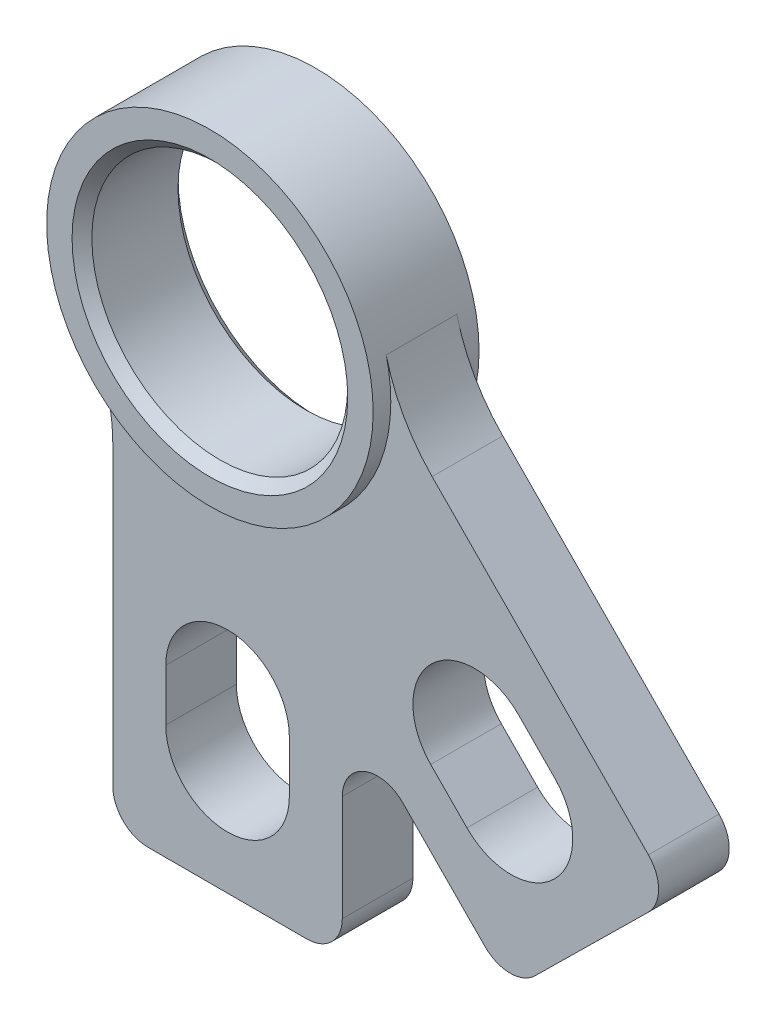
from build123d import *

# Parameters (mm, degrees)
SKETCH1_R           = 11.5062
BOSS_EXTRUDE2_DEPTH = 4.7625
BOSS_EXTRUDE3_DEPTH = 3.175
FILLET1_R           = 3.175
CHAMFER1_SIZE       = 0.889


with BuildPart() as part:
    # Sketch1 → Boss-Extrude2 (new, symmetric)
    with BuildSketch(Plane.XY):
        with BuildLine():
            ThreePointArc((14.269628052, 3.451861627), (-5.569873551, 13.583598274), (-12.585193267, -7.559797873))
            ThreePointArc((-12.585193267, -7.559797873), (5.569873551, -13.583598274), (14.269628052, 3.451861627))
        make_face()
        Circle(SKETCH1_R, mode=Mode.SUBTRACT)
    extrude(amount=BOSS_EXTRUDE2_DEPTH, both=True)

    # Sketch1<4> → Boss-Extrude3 (add, symmetric)
    with BuildSketch(Plane.XY):
        with BuildLine():
            ThreePointArc((-12.585193267, -7.559797873), (-10.89585042, -11.492870345), (-10.31875, -15.734319794))
            Line((-10.31875, -15.734319794), (-10.31875, -45.604827057))
            Line((-10.31875, -45.604827057), (10.31875, -45.604827057))
            Line((10.31875, -45.604827057), (10.31875, -25.164979673))
            Line((10.31875, -25.164979673), (25.381793208, -40.444315924))
            Line((25.381793208, -40.444315924), (40.07836036, -25.955792184))
            Line((40.07836036, -25.955792184), (18.394537525, -3.960607297))
            ThreePointArc((18.394537525, -3.960607297), (15.827804832, -0.534994709), (14.269628052, 3.451861627))
            ThreePointArc((14.269628052, 3.451861627), (5.569873551, -13.583598274), (-12.585193267, -7.559797873))
        make_face()
        with BuildLine():
            ThreePointArc((5.55625, -35.286077057), (0, -40.842327057), (-5.55625, -35.286077057))
            Line((-5.55625, -35.286077057), (-5.55625, -30.63875))
            ThreePointArc((-5.55625, -30.63875), (0, -25.0825), (5.55625, -30.63875))
            Line((5.55625, -30.63875), (5.55625, -35.286077057))
        make_face(mode=Mode.SUBTRACT)
        with BuildLine():
            ThreePointArc((29.442582993, -21.951014086), (29.386571305, -29.808538557), (21.529046834, -29.752526869))
            Line((21.529046834, -29.752526869), (18.266398335, -26.443029393))
            ThreePointArc((18.266398335, -26.443029393), (18.322410023, -18.585504922), (26.179934494, -18.64151661))
            Line((26.179934494, -18.64151661), (29.442582993, -21.951014086))
        make_face(mode=Mode.SUBTRACT)
    extrude(amount=BOSS_EXTRUDE3_DEPTH, both=True)

    # Fillet1
    fillet1_edges = [part.edges().sort_by_distance(p)[0] for p in [
        (-10.31875, -45.604827057, 0),
        (40.07836036, -25.955792184, 0),
        (10.31875, -25.164979673, 0),
        (25.381793208, -40.444315924, 0),
        (10.31875, -45.604827057, 0),
    ]]
    fillet(fillet1_edges, radius=FILLET1_R)

    # Chamfer1
    chamfer1_edges = [part.edges().sort_by_distance(p)[0] for p in [
        (-11.5062, 0, -4.7625),
        (-11.5062, 0, 4.7625),
    ]]
    chamfer(chamfer1_edges, length=CHAMFER1_SIZE)


solid = part.part
